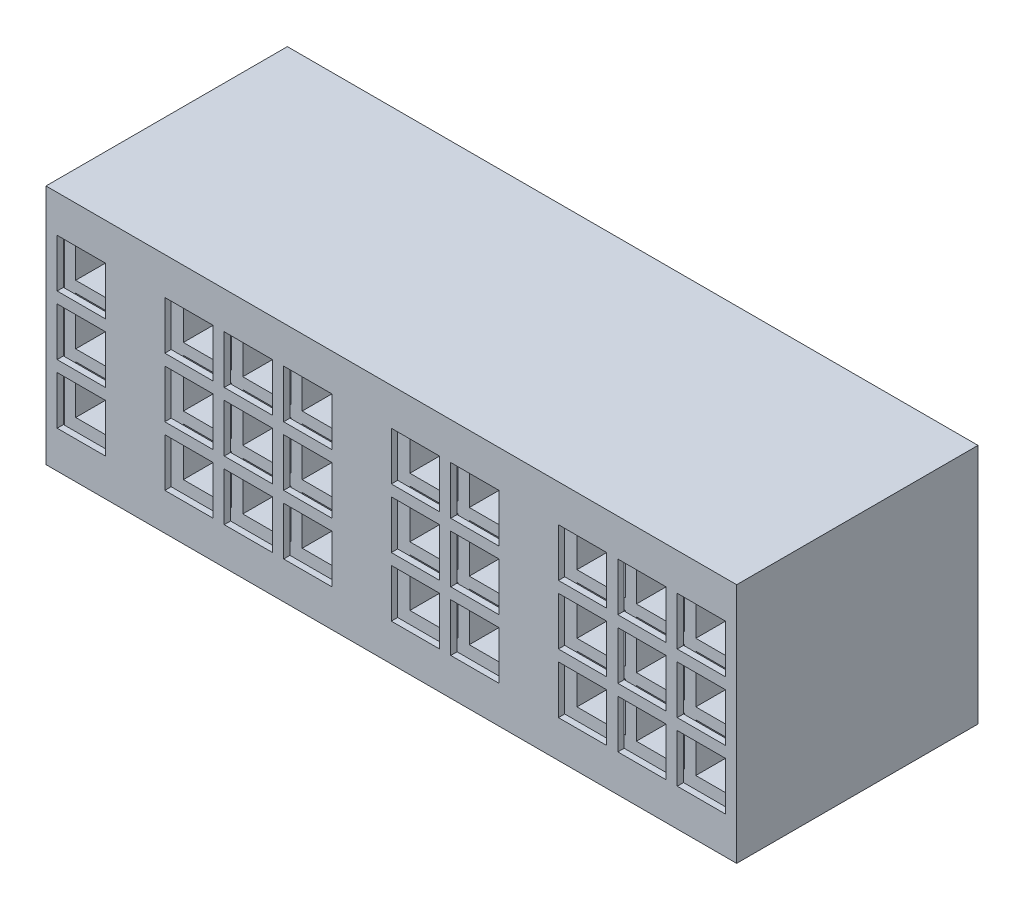
from build123d import *

# Parameters (mm, degrees)
ESQUISSE1_W                     = 186
ESQUISSE1_H                     = 51
BOSS_EXTRU_1_DEPTH              = 35
ESQUISSE7_W                     = 13
ESQUISSE7_H                     = 13
ENL_V_MAT_EXTRU_5_DEPTH         = 91
R_P_TITION_LIN_AIRE5_COUNT      = 3
R_P_TITION_LIN_AIRE5_PITCH      = 16
ESQUISSE8_W                     = 13
ESQUISSE8_H                     = 13
ENL_V_MAT_EXTRU_6_DEPTH         = 103
R_P_TITION_LIN_AIRE6_COUNT      = 3
R_P_TITION_LIN_AIRE6_PITCH      = 16
R_P_TITION_LIN_AIRE6_COUNT_DIR2 = 3
R_P_TITION_LIN_AIRE6_PITCH_DIR2 = 16
ESQUISSE9_W                     = 13
ESQUISSE9_H                     = 13
ENL_V_MAT_EXTRU_7_DEPTH         = 77
R_P_TITION_LIN_AIRE7_COUNT      = 3
R_P_TITION_LIN_AIRE7_PITCH      = 16
R_P_TITION_LIN_AIRE7_COUNT_DIR2 = 2
R_P_TITION_LIN_AIRE7_PITCH_DIR2 = 16
ESQUISSE10_W                    = 13
ESQUISSE10_H                    = 13
ENL_V_MAT_EXTRU_8_DEPTH         = 78
R_P_TITION_LIN_AIRE8_COUNT      = 3
R_P_TITION_LIN_AIRE8_PITCH      = 16
R_P_TITION_LIN_AIRE8_COUNT_DIR2 = 3
R_P_TITION_LIN_AIRE8_PITCH_DIR2 = 16
ESQUISSE14_W                    = 10
ESQUISSE14_H                    = 5
BOSS_EXTRU_3_DEPTH              = 7
ESQUISSE25_W                    = 186
ESQUISSE25_H                    = 35
BOSS_EXTRU_7_DEPTH              = 7
ESQUISSE18_W                    = 186
ESQUISSE18_H                    = 35
BOSS_EXTRU_5_DEPTH              = 7
ESQUISSE16_W                    = 3.3
ESQUISSE16_H                    = 55
ENL_V_MAT_EXTRU_11_DEPTH        = 184
ESQUISSE15_R                    = 1
ENL_V_MAT_EXTRU_10_DEPTH        = 7
ESQUISSE24_W                    = 10
ESQUISSE24_H                    = 2
ENL_V_MAT_EXTRU_12_DEPTH        = 1
ESQUISSE19_W                    = 186
ESQUISSE19_H                    = 1
ESQUISSE19_W_2                  = 1
ESQUISSE19_H_2                  = 63
BOSS_EXTRU_8_DEPTH              = 30
ESQUISSE26_R                    = 1.75
ENL_V_MAT_EXTRU_14_DEPTH        = 30


with BuildPart() as part:
    # Esquisse1 → Boss.-Extru.1 (new body)
    with BuildSketch(Plane.XY):
        with Locations((0, -25.5)):
            Rectangle(ESQUISSE1_W, ESQUISSE1_H)
    extrude(amount=BOSS_EXTRU_1_DEPTH)

    # Esquisse7 → Enlèv. mat.-Extru.5 (cut)
    with BuildSketch(Plane.XY.offset(35)):
        with Locations((-83.5, -9.5)):
            Rectangle(ESQUISSE7_W, ESQUISSE7_H)
    enl_v_mat_extru_5 = extrude(amount=-ENL_V_MAT_EXTRU_5_DEPTH, mode=Mode.SUBTRACT)

    # Répétition linéaire5: Enlèv. mat.-Extru.5 ×3
    with Locations(*[(0, -i * R_P_TITION_LIN_AIRE5_PITCH, 0) for i in range(1, R_P_TITION_LIN_AIRE5_COUNT)]):
        add(enl_v_mat_extru_5, mode=Mode.SUBTRACT)

    # Esquisse8 → Enlèv. mat.-Extru.6 (cut)
    with BuildSketch(Plane.XY.offset(35)):
        with Locations((-54.5, -9.5)):
            Rectangle(ESQUISSE8_W, ESQUISSE8_H)
    enl_v_mat_extru_6 = extrude(amount=-ENL_V_MAT_EXTRU_6_DEPTH, mode=Mode.SUBTRACT)

    # Répétition linéaire6: Enl_v. mat.-Extru.6 3 × 3
    with Locations(*[(j * R_P_TITION_LIN_AIRE6_PITCH_DIR2, -i * R_P_TITION_LIN_AIRE6_PITCH, 0) for i in range(R_P_TITION_LIN_AIRE6_COUNT) for j in range(R_P_TITION_LIN_AIRE6_COUNT_DIR2) if (i, j) != (0, 0)]):
        add(enl_v_mat_extru_6, mode=Mode.SUBTRACT)

    # Esquisse9 → Enlèv. mat.-Extru.7 (cut)
    with BuildSketch(Plane.XY.offset(35)):
        with Locations((6.5, -9.5)):
            Rectangle(ESQUISSE9_W, ESQUISSE9_H)
    enl_v_mat_extru_7 = extrude(amount=-ENL_V_MAT_EXTRU_7_DEPTH, mode=Mode.SUBTRACT)

    # Répétition linéaire7: Enl_v. mat.-Extru.7 3 × 2
    with Locations(*[(j * R_P_TITION_LIN_AIRE7_PITCH_DIR2, -i * R_P_TITION_LIN_AIRE7_PITCH, 0) for i in range(R_P_TITION_LIN_AIRE7_COUNT) for j in range(R_P_TITION_LIN_AIRE7_COUNT_DIR2) if (i, j) != (0, 0)]):
        add(enl_v_mat_extru_7, mode=Mode.SUBTRACT)

    # Esquisse10 → Enlèv. mat.-Extru.8 (cut)
    with BuildSketch(Plane.XY.offset(35)):
        with Locations((51.5, -9.5)):
            Rectangle(ESQUISSE10_W, ESQUISSE10_H)
    enl_v_mat_extru_8 = extrude(amount=-ENL_V_MAT_EXTRU_8_DEPTH, mode=Mode.SUBTRACT)

    # Répétition linéaire8: Enl_v. mat.-Extru.8 3 × 3
    with Locations(*[(i * R_P_TITION_LIN_AIRE8_PITCH, -j * R_P_TITION_LIN_AIRE8_PITCH_DIR2, 0) for i in range(R_P_TITION_LIN_AIRE8_COUNT) for j in range(R_P_TITION_LIN_AIRE8_COUNT_DIR2) if (i, j) != (0, 0)]):
        add(enl_v_mat_extru_8, mode=Mode.SUBTRACT)

    # Esquisse14 → Boss.-Extru.3 (add)
    with BuildSketch(Plane.XZ.offset(51)):
        with Locations((-7.663083533, 2.5)):
            Rectangle(ESQUISSE14_W, ESQUISSE14_H)
    extrude(amount=BOSS_EXTRU_3_DEPTH)

    # Esquisse25 → Boss.-Extru.7 (add)
    with BuildSketch(Plane(origin=(0, 0, 0), x_dir=(1, 0, 0), z_dir=(0, 1, 0))):
        with Locations((0, -17.5)):
            Rectangle(ESQUISSE25_W, ESQUISSE25_H)
    extrude(amount=BOSS_EXTRU_7_DEPTH)

    # Esquisse18 → Boss.-Extru.5 (add)
    with BuildSketch(Plane.XZ.offset(51)):
        with Locations((0, 17.5)):
            Rectangle(ESQUISSE18_W, ESQUISSE18_H)
    extrude(amount=BOSS_EXTRU_5_DEPTH)

    # Esquisse16 → Enlèv. mat.-Extru.11 (cut)
    with BuildSketch(Plane.ZY.offset(93)):
        with Locations((31.65, -25.5)):
            Rectangle(ESQUISSE16_W, ESQUISSE16_H)
    extrude(amount=-ENL_V_MAT_EXTRU_11_DEPTH, mode=Mode.SUBTRACT)

    # Esquisse15 → Enlèv. mat.-Extru.10 (cut)
    with BuildSketch(Plane(origin=(0, 0, 0), x_dir=(-1, 0, 0), z_dir=(0, 0, -1))):
        with Locations((8.482305804, -42.446555864)):
            Circle(ESQUISSE15_R)
        with Locations((8.482305804, -9.749028666)):
            Circle(ESQUISSE15_R)
        with Locations((68.823038652, -42.446555864)):
            Circle(ESQUISSE15_R)
        with Locations((68.823038652, -9.749028666)):
            Circle(ESQUISSE15_R)
        with Locations((-37.13548256, -42.446555864)):
            Circle(ESQUISSE15_R)
        with Locations((-39.215855023, -11.260648292)):
            Circle(ESQUISSE15_R)
    extrude(amount=-ENL_V_MAT_EXTRU_10_DEPTH, mode=Mode.SUBTRACT)

    # Esquisse24 → Enlèv. mat.-Extru.12 (cut)
    with BuildSketch(Plane(origin=(0, 0, 0), x_dir=(-1, 0, 0), z_dir=(0, 0, -1))):
        with Locations((83.5, -49)):
            Rectangle(ESQUISSE24_W, ESQUISSE24_H)
        with Locations((54.5, -49)):
            Rectangle(ESQUISSE24_W, ESQUISSE24_H)
        with Locations((38.5, -49)):
            Rectangle(ESQUISSE24_W, ESQUISSE24_H)
        with Locations((22.5, -49)):
            Rectangle(ESQUISSE24_W, ESQUISSE24_H)
        with Locations((-6.5, -49)):
            Rectangle(ESQUISSE24_W, ESQUISSE24_H)
        with Locations((-22.5, -49)):
            Rectangle(ESQUISSE24_W, ESQUISSE24_H)
        with Locations((-51.5, -49)):
            Rectangle(ESQUISSE24_W, ESQUISSE24_H)
        with Locations((-67.5, -49)):
            Rectangle(ESQUISSE24_W, ESQUISSE24_H)
        with Locations((-83.5, -49)):
            Rectangle(ESQUISSE24_W, ESQUISSE24_H)
        with Locations((-83.5, -2)):
            Rectangle(ESQUISSE24_W, ESQUISSE24_H)
        with Locations((-67.5, -2)):
            Rectangle(ESQUISSE24_W, ESQUISSE24_H)
        with Locations((-51.5, -2)):
            Rectangle(ESQUISSE24_W, ESQUISSE24_H)
        with Locations((-22.5, -2)):
            Rectangle(ESQUISSE24_W, ESQUISSE24_H)
        with Locations((-6.5, -2)):
            Rectangle(ESQUISSE24_W, ESQUISSE24_H)
        with Locations((22.5, -2)):
            Rectangle(ESQUISSE24_W, ESQUISSE24_H)
        with Locations((38.5, -2)):
            Rectangle(ESQUISSE24_W, ESQUISSE24_H)
        with Locations((54.5, -2)):
            Rectangle(ESQUISSE24_W, ESQUISSE24_H)
        with Locations((83.5, -2)):
            Rectangle(ESQUISSE24_W, ESQUISSE24_H)
    extrude(amount=-ENL_V_MAT_EXTRU_12_DEPTH, mode=Mode.SUBTRACT)

    # Esquisse19 → Boss.-Extru.8 (add)
    with BuildSketch(Plane(origin=(0, 0, 0), x_dir=(-1, 0, 0), z_dir=(0, 0, -1))):
        with Locations((0, -57.5)):
            Rectangle(ESQUISSE19_W, ESQUISSE19_H)
        with Locations((92.5, -25.5)):
            Rectangle(ESQUISSE19_W_2, ESQUISSE19_H_2)
        with Locations((0, 6.5)):
            Rectangle(ESQUISSE19_W, ESQUISSE19_H)
        with Locations((-92.5, -25.5)):
            Rectangle(ESQUISSE19_W_2, ESQUISSE19_H_2)
    extrude(amount=BOSS_EXTRU_8_DEPTH)

    # Esquisse26 → Enlèv. mat.-Extru.14 (cut)
    with BuildSketch(Plane.ZY.offset(93)):
        with Locations((-13.75, -25.5)):
            Circle(ESQUISSE26_R)
    extrude(amount=-ENL_V_MAT_EXTRU_14_DEPTH, mode=Mode.SUBTRACT)


solid = part.part
